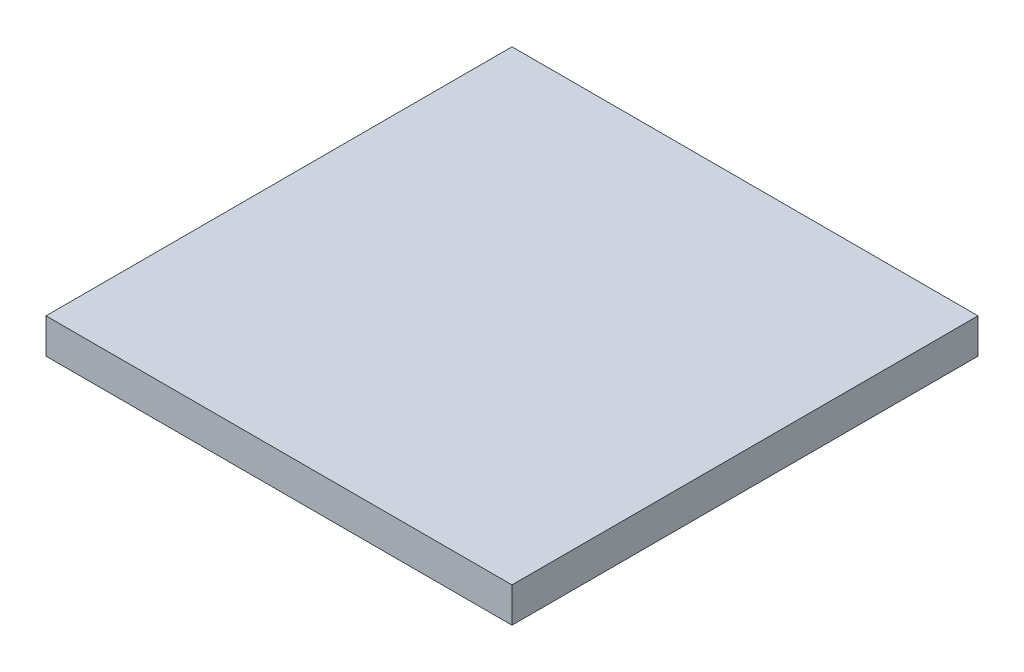
from build123d import *

# Parameters (mm, degrees)
SKETCH_1_R      = 8
EXTRUDE_1_DEPTH = 2
SKETCH_2_R      = 2
EXTRUDE_2_DEPTH = 5
SKETCH_3_W      = 40
SKETCH_3_H      = 40
EXTRUDE_3_DEPTH = 3


with BuildPart() as part:
    # 草图1 → 凸台-拉伸1 (new body)
    with BuildSketch(Plane(origin=(0, 0, 0), x_dir=(1, 0, 0), z_dir=(0, 1, 0))):
        with Locations(Location((0, 0, 0), (0, 0, 270))):
            Circle(SKETCH_1_R)
    extrude(amount=EXTRUDE_1_DEPTH)

    # 草图2 → 凸台-拉伸2 (add)
    with BuildSketch(Plane(origin=(0, 2, 0), x_dir=(1, 0, 0), z_dir=(0, 1, 0))):
        with Locations(Location((0, 0, 0), (0, 0, 270))):
            Circle(SKETCH_2_R)
    extrude(amount=EXTRUDE_2_DEPTH)

    # 草图3 → 凸台-拉伸3 (add)
    with BuildSketch(Plane(origin=(0, 7, 0), x_dir=(1, 0, 0), z_dir=(0, 1, 0))):
        Rectangle(SKETCH_3_W, SKETCH_3_H)
    extrude(amount=EXTRUDE_3_DEPTH)


solid = part.part
